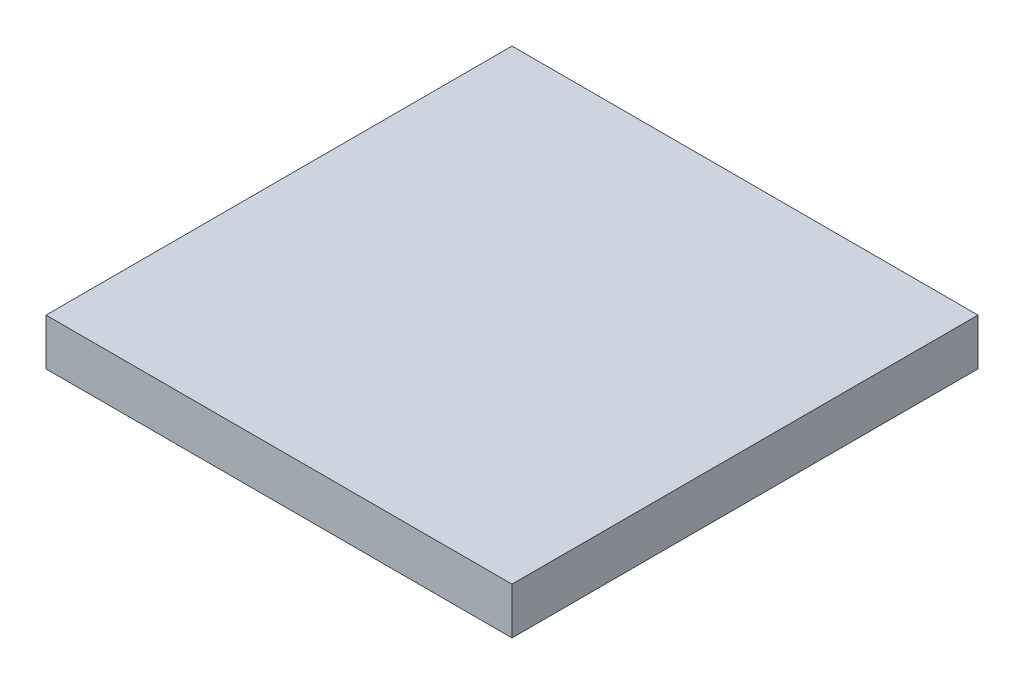
from build123d import *

# Parameters (mm, degrees)
SKETCH1_W           = 100
SKETCH1_H           = 100
BOSS_EXTRUDE1_DEPTH = 10


with BuildPart() as part:
    # Sketch1 → Boss-Extrude1 (new body)
    with BuildSketch(Plane(origin=(0, 0, 0), x_dir=(1, 0, 0), z_dir=(0, 1, 0))):
        Rectangle(SKETCH1_W, SKETCH1_H)
    extrude(amount=BOSS_EXTRUDE1_DEPTH)


solid = part.part
